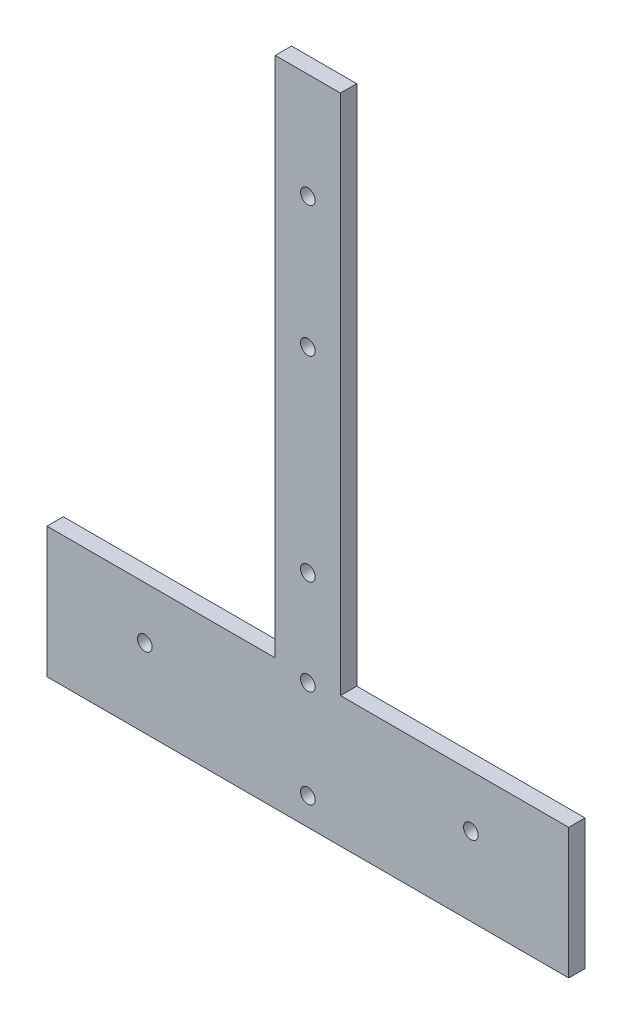
from build123d import *

# Parameters (mm, degrees)
SKETCH1_W           = 20
SKETCH1_H           = 160
SKETCH1_H_2         = 40
SKETCH1_W_2         = 70
BOSS_EXTRUDE1_DEPTH = 5
SKETCH2_R           = 2.25
CUT_EXTRUDE1_DEPTH  = 15


with BuildPart() as part:
    # Sketch1 → Boss-Extrude1 (new body)
    with BuildSketch(Plane.XY):
        with Locations((0, 20)):
            Rectangle(SKETCH1_W, SKETCH1_H)
        with Locations((0, -80)):
            Rectangle(SKETCH1_W, SKETCH1_H_2)
        with Locations((-45, -80)):
            Rectangle(SKETCH1_W_2, SKETCH1_H_2)
        with Locations((45, -80)):
            Rectangle(SKETCH1_W_2, SKETCH1_H_2)
    extrude(amount=BOSS_EXTRUDE1_DEPTH)

    # Sketch2 → Cut-Extrude1 (cut)
    with BuildSketch(Plane.XY.offset(5)):
        with Locations((0, -91.6)):
            Circle(SKETCH2_R)
        with Locations((-50, -76)):
            Circle(SKETCH2_R)
        with Locations((50, -76)):
            Circle(SKETCH2_R)
        with Locations((0, 27.6)):
            Circle(SKETCH2_R)
        with Locations((0, 67.6)):
            Circle(SKETCH2_R)
        with Locations((0, -32.4)):
            Circle(SKETCH2_R)
        with Locations((0, -61.6)):
            Circle(SKETCH2_R)
    extrude(amount=-CUT_EXTRUDE1_DEPTH, mode=Mode.SUBTRACT)


solid = part.part
